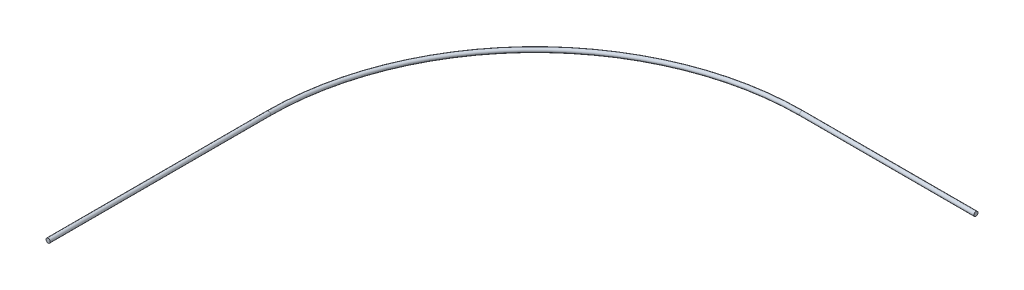
from build123d import *

# Parameters (mm, degrees)
SKETCH3_R = 0.02


with BuildPart() as part:
    # Sweep1: sweep along a path in Sketch1
    with BuildLine(Plane(origin=(0, 0, 0), x_dir=(1, 0, 0), z_dir=(0, 1, 0))) as sweep1_path:
        Line((0, 0), (0, 2.1))
        ThreePointArc((0, 2.1), (0.743948776, 3.896051224), (2.54, 4.64))
        Line((2.54, 4.64), (4.2, 4.64))
    # Sketch3 → Sweep1 (sweep)
    with BuildSketch(Plane.XY):
        Circle(SKETCH3_R)
    sweep(path=sweep1_path.line)


solid = part.part
